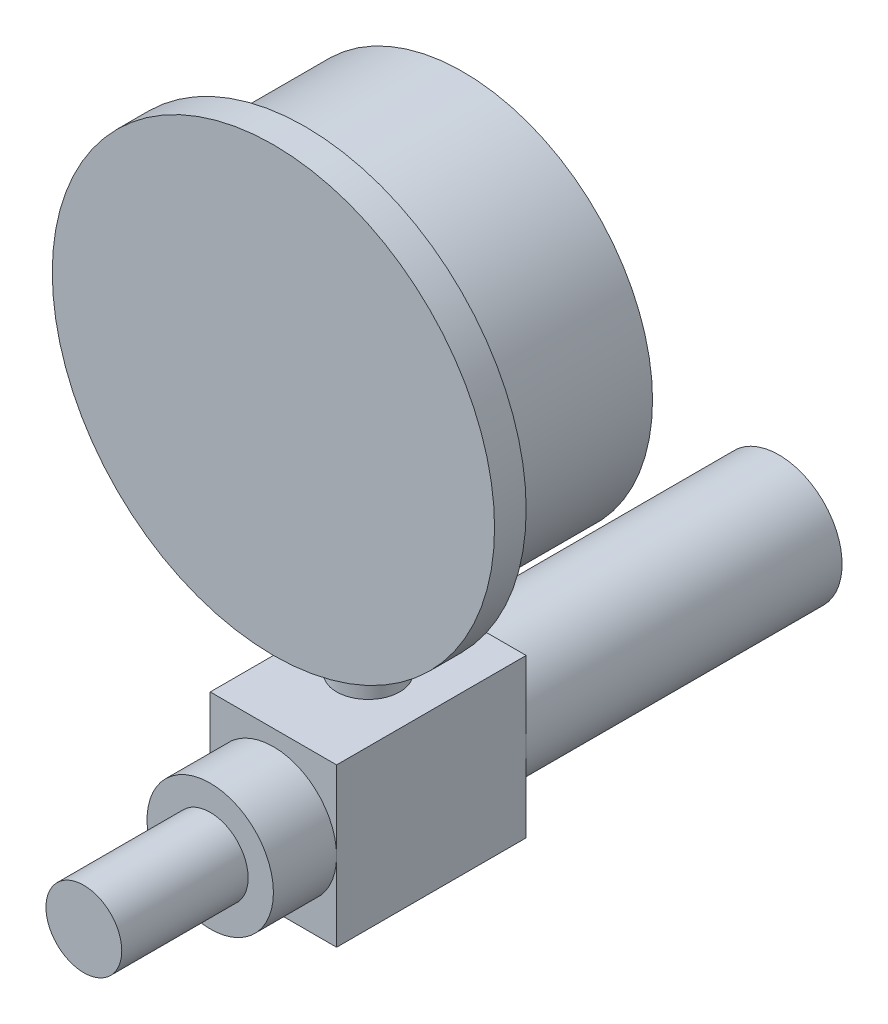
from build123d import *

# Parameters (mm, degrees)
CROQUIS1_R                   = 30
SALIENTE_EXTRUIR1_DEPTH      = 30
CROQUIS1_W                   = 20
CROQUIS1_H                   = 25
SALIENTE_EXTRUIR1_2_DEPTH    = 30
CROQUIS2_R                   = 35
CROQUIS2_R_2                 = 30
SALIENTE_EXTRUIR2_DEPTH      = 5
SALIENTE_EXTRUIR3_REACH      = 94.331
SALIENTE_EXTRUIR3_END_RADIUS = 30
CROQUIS3_R                   = 5
CROQUIS4_R                   = 10
SALIENTE_EXTRUIR4_DEPTH      = 10
CROQUIS5_R                   = 6
SALIENTE_EXTRUIR5_DEPTH      = 20
SALIENTE_EXTRUIR6_START      = 50
CROQUIS6_R                   = 10
SALIENTE_EXTRUIR6_DEPTH      = 50


with BuildPart() as part:
    # Croquis1 → Saliente-Extruir1 (new body)
    with BuildSketch(Plane.XY):
        with Locations((0, 20)):
            Circle(CROQUIS1_R)
    extrude(amount=-SALIENTE_EXTRUIR1_DEPTH)

    # Croquis2 → Saliente-Extruir2 (add)
    with BuildSketch(Plane.XY):
        with Locations((0, 20)):
            Circle(CROQUIS2_R)
        with Locations((0, 20)):
            Circle(CROQUIS2_R_2, mode=Mode.SUBTRACT)
    extrude(amount=-SALIENTE_EXTRUIR2_DEPTH)



with BuildPart() as body_2:
    # Croquis1 → Saliente-Extruir1 2 (new body)
    with BuildSketch(Plane.XY):
        with Locations((0, -37.5)):
            Rectangle(CROQUIS1_W, CROQUIS1_H)
    extrude(amount=-SALIENTE_EXTRUIR1_2_DEPTH)


with BuildPart() as part_1:
    add(part.part)

    add(body_2.part)  # Saliente-Extruir3 merges body 2
    # Saliente-Extruir3: up to this cylinder (the profile starts outside it)
    saliente_extruir3_end = Plane(origin=(0, 20, -15), z_dir=(0, 0, 1)) * Cylinder(SALIENTE_EXTRUIR3_END_RADIUS, 249.662, mode=Mode.PRIVATE)
    # Croquis3 → Saliente-Extruir3 (add, up to the surface)
    with BuildSketch(Plane(origin=(0, -25, 0), x_dir=(1, 0, 0), z_dir=(0, 1, 0)), mode=Mode.PRIVATE) as saliente_extruir3_sk1:
        with Locations(Location((0, 15, 0), (0, 0, 90))):
            Circle(CROQUIS3_R)
    saliente_extruir3_tool1 = extrude(saliente_extruir3_sk1.sketch, amount=SALIENTE_EXTRUIR3_REACH, mode=Mode.PRIVATE) - saliente_extruir3_end
    add(saliente_extruir3_tool1.solids().sort_by_distance((0, -25, -15))[0])

    # Croquis4 → Saliente-Extruir4 (add)
    with BuildSketch(Plane.XY):
        with Locations((0, -37.5)):
            Circle(CROQUIS4_R)
    extrude(amount=SALIENTE_EXTRUIR4_DEPTH)

    # Croquis5 → Saliente-Extruir5 (add)
    with BuildSketch(Plane.XY.offset(10)):
        with Locations((0, -37.5)):
            Circle(CROQUIS5_R)
    extrude(amount=SALIENTE_EXTRUIR5_DEPTH)

    # Croquis6 → Saliente-Extruir6 (add)
    with BuildSketch(Plane(origin=(0, 0, -30), x_dir=(-1, 0, 0), z_dir=(0, 0, -1)).offset(SALIENTE_EXTRUIR6_START)):
        with Locations(Location((0, -37.5, 0), (0, 0, 180))):
            Circle(CROQUIS6_R)
    extrude(amount=-SALIENTE_EXTRUIR6_DEPTH)


solid = part_1.part
